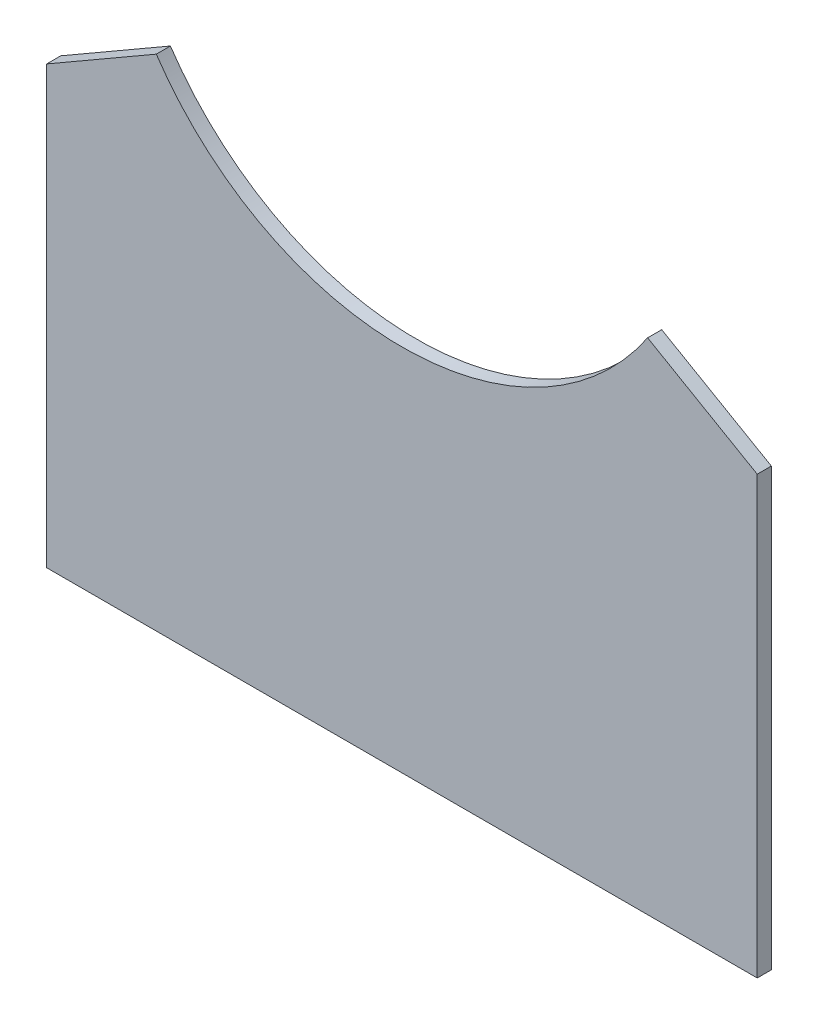
from build123d import *

# Parameters (mm, degrees)
BOSS_EXTRUDE1_DEPTH = 6.35


with BuildPart() as part:
    # Sketch1 → Boss-Extrude1 (new, symmetric)
    with BuildSketch(Plane.XY):
        with BuildLine():
            Line((-221.273103969, -148.886209771), (-320, -205.886209771))
            Line((-320, -205.886209771), (-320, -598.886209771))
            Line((-320, -598.886209771), (320, -598.886209771))
            Line((320, -598.886209771), (320, -205.886209771))
            Line((320, -205.886209771), (221.273103969, -148.886209771))
            ThreePointArc((221.273103969, -148.886209771), (0, -266.7), (-221.273103969, -148.886209771))
        make_face()
    extrude(amount=BOSS_EXTRUDE1_DEPTH, both=True)


solid = part.part
